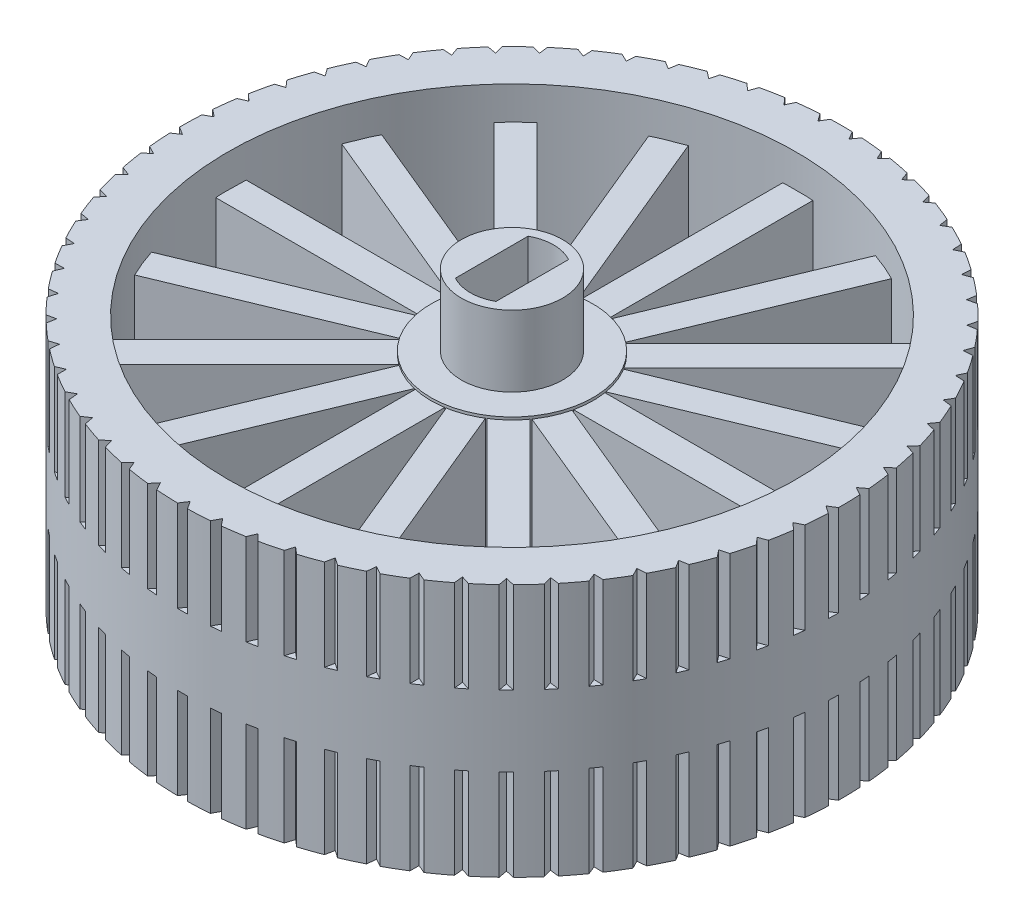
from build123d import *

# Parameters (mm, degrees)
SKETCH1_R               = 32.5
BOSS_EXTRUDE1_DEPTH     = 2
SKETCH2_R               = 4
BOSS_EXTRUDE2_DEPTH     = 2
CUT_EXTRUDE1_DEPTH      = 28
SKETCH5_R               = 8
BOSS_EXTRUDE3_DEPTH     = 2
CUT_EXTRUDE2_DEPTH      = 18
CUT_EXTRUDE2_DEPTH_BACK = 37.005434462
CUT_EXTRUDE2_START      = -10
SKETCH7_R               = 32.5
SKETCH7_R_2             = 28
BOSS_EXTRUDE4_DEPTH     = 23
BOSS_EXTRUDE5_START     = 25
SKETCH9_R               = 8
BOSS_EXTRUDE5_DEPTH     = 25
SKETCH12_W              = 3
SKETCH12_H              = 19.736770602
BOSS_EXTRUDE6_DEPTH     = 22
CIRPATTERN2_COUNT       = 16
CUT_EXTRUDE3_START      = -22
SKETCH13_R              = 28
CUT_EXTRUDE3_DEPTH      = 22
CUT_EXTRUDE6_DEPTH      = 9
SKETCH16_R              = 8
SKETCH16_R_2            = 5
CUT_EXTRUDE7_DEPTH      = 7


with BuildPart() as part:
    # Sketch1 → Boss-Extrude1 (new body)
    with BuildSketch(Plane(origin=(0, 0, 0), x_dir=(1, 0, 0), z_dir=(0, 1, 0))):
        with Locations(Location((0, 0, 0), (0, 0, 270))):
            Circle(SKETCH1_R)
    extrude(amount=BOSS_EXTRUDE1_DEPTH)

    # Sketch2 → Boss-Extrude2 (add)
    with BuildSketch(Plane(origin=(0, 2, 0), x_dir=(1, 0, 0), z_dir=(0, 1, 0))):
        with Locations(Location((0, 0, 0), (0, 0, 270))):
            Circle(SKETCH2_R)
    extrude(amount=BOSS_EXTRUDE2_DEPTH)

    # Sketch4 → Cut-Extrude1 (cut)
    with BuildSketch(Plane(origin=(0, 4, 0), x_dir=(1, 0, 0), z_dir=(0, 1, 0))):
        with BuildLine():
            Line((1.995, -3.581895448), (1.995, 3.581895448))
            ThreePointArc((1.995, 3.581895448), (0, 4.1), (-1.995, 3.581895448))
            Line((-1.995, 3.581895448), (-1.995, -3.581895448))
            ThreePointArc((-1.995, -3.581895448), (0, -4.1), (1.995, -3.581895448))
        make_face()
    extrude(amount=-CUT_EXTRUDE1_DEPTH, mode=Mode.SUBTRACT)

    # Sketch5 → Boss-Extrude3 (add)
    with BuildSketch(Plane(origin=(0, 2, 0), x_dir=(1, 0, 0), z_dir=(0, 1, 0))):
        with Locations(Location((0, 0, 0), (0, 0, 270))):
            Circle(SKETCH5_R)
    extrude(amount=BOSS_EXTRUDE3_DEPTH)

    # Sketch6 → Cut-Extrude2 (cut, two sides: drawn at the far end of the back side and taken through both)
    with BuildSketch(Plane.XZ.offset(-2).offset(CUT_EXTRUDE2_START - CUT_EXTRUDE2_DEPTH_BACK)):
        with BuildLine():
            Line((-1.995, 3.581895448), (-1.995, -3.581895448))
            ThreePointArc((-1.995, -3.581895448), (0, -4.1), (1.995, -3.581895448))
            Line((1.995, -3.581895448), (1.995, 3.581895448))
            ThreePointArc((1.995, 3.581895448), (0, 4.1), (-1.995, 3.581895448))
        make_face()
    extrude(amount=CUT_EXTRUDE2_DEPTH + CUT_EXTRUDE2_DEPTH_BACK, mode=Mode.SUBTRACT)

    # Sketch7 → Boss-Extrude4 (add)
    with BuildSketch(Plane(origin=(0, 2, 0), x_dir=(1, 0, 0), z_dir=(0, 1, 0))):
        with Locations(Location((0, 0, 0), (0, 0, 270))):
            Circle(SKETCH7_R)
        with Locations(Location((0, 0, 0), (0, 0, 270))):
            Circle(SKETCH7_R_2, mode=Mode.SUBTRACT)
    extrude(amount=BOSS_EXTRUDE4_DEPTH)

    # Sketch9 → Boss-Extrude5 (add)
    with BuildSketch(Plane(origin=(0, 4, 0), x_dir=(1, 0, 0), z_dir=(0, 1, 0)).offset(BOSS_EXTRUDE5_START)):
        with Locations(Location((0, 0, 0), (0, 0, 270))):
            Circle(SKETCH9_R)
        with BuildLine():
            Line((-1.995, -3.581895448), (-1.995, 3.581895448))
            ThreePointArc((-1.995, 3.581895448), (0, 4.1), (1.995, 3.581895448))
            Line((1.995, 3.581895448), (1.995, -3.581895448))
            ThreePointArc((1.995, -3.581895448), (0, -4.1), (-1.995, -3.581895448))
        make_face(mode=Mode.SUBTRACT)
    extrude(amount=-BOSS_EXTRUDE5_DEPTH)

    # Sketch13 → Cut-Extrude3 (cut)
    with BuildSketch(Plane(origin=(0, 2, 0), x_dir=(1, 0, 0), z_dir=(0, 1, 0)).offset(CUT_EXTRUDE3_START)):
        with Locations(Location((0, 0, 0), (0, 0, 270))):
            Circle(SKETCH13_R)
    extrude(amount=CUT_EXTRUDE3_DEPTH, mode=Mode.SUBTRACT)


with BuildPart() as body_2:
    # Sketch12 → Boss-Extrude6 (new body)
    with BuildSketch(Plane(origin=(-6.995, 0, 0), x_dir=(0, 0, -1), z_dir=(1, 0, 0))):
        with Locations((0.23460174, 11.868385301)):
            Rectangle(SKETCH12_W, SKETCH12_H)
    extrude(amount=-BOSS_EXTRUDE6_DEPTH)


with BuildPart() as cirpattern2_1:
    # CirPattern2: pattern copy
    add(body_2.part.rotate(Axis((0, 0, 0), (0, 1, 0)), 1 * 360 / CIRPATTERN2_COUNT))


with BuildPart() as cirpattern2_2:
    # CirPattern2: pattern copy
    add(body_2.part.rotate(Axis((0, 0, 0), (0, 1, 0)), 2 * 360 / CIRPATTERN2_COUNT))


with BuildPart() as cirpattern2_3:
    # CirPattern2: pattern copy
    add(body_2.part.rotate(Axis((0, 0, 0), (0, 1, 0)), 3 * 360 / CIRPATTERN2_COUNT))


with BuildPart() as cirpattern2_4:
    # CirPattern2: pattern copy
    add(body_2.part.rotate(Axis((0, 0, 0), (0, 1, 0)), 4 * 360 / CIRPATTERN2_COUNT))


with BuildPart() as cirpattern2_5:
    # CirPattern2: pattern copy
    add(body_2.part.rotate(Axis((0, 0, 0), (0, 1, 0)), 5 * 360 / CIRPATTERN2_COUNT))


with BuildPart() as cirpattern2_6:
    # CirPattern2: pattern copy
    add(body_2.part.rotate(Axis((0, 0, 0), (0, 1, 0)), 6 * 360 / CIRPATTERN2_COUNT))


with BuildPart() as cirpattern2_7:
    # CirPattern2: pattern copy
    add(body_2.part.rotate(Axis((0, 0, 0), (0, 1, 0)), 7 * 360 / CIRPATTERN2_COUNT))


with BuildPart() as cirpattern2_8:
    # CirPattern2: pattern copy
    add(body_2.part.rotate(Axis((0, 0, 0), (0, 1, 0)), 8 * 360 / CIRPATTERN2_COUNT))


with BuildPart() as cirpattern2_9:
    # CirPattern2: pattern copy
    add(body_2.part.rotate(Axis((0, 0, 0), (0, 1, 0)), 9 * 360 / CIRPATTERN2_COUNT))


with BuildPart() as cirpattern2_10:
    # CirPattern2: pattern copy
    add(body_2.part.rotate(Axis((0, 0, 0), (0, 1, 0)), 10 * 360 / CIRPATTERN2_COUNT))


with BuildPart() as cirpattern2_11:
    # CirPattern2: pattern copy
    add(body_2.part.rotate(Axis((0, 0, 0), (0, 1, 0)), 11 * 360 / CIRPATTERN2_COUNT))


with BuildPart() as cirpattern2_12:
    # CirPattern2: pattern copy
    add(body_2.part.rotate(Axis((0, 0, 0), (0, 1, 0)), 12 * 360 / CIRPATTERN2_COUNT))


with BuildPart() as cirpattern2_13:
    # CirPattern2: pattern copy
    add(body_2.part.rotate(Axis((0, 0, 0), (0, 1, 0)), 13 * 360 / CIRPATTERN2_COUNT))


with BuildPart() as cirpattern2_14:
    # CirPattern2: pattern copy
    add(body_2.part.rotate(Axis((0, 0, 0), (0, 1, 0)), 14 * 360 / CIRPATTERN2_COUNT))


with BuildPart() as cirpattern2_15:
    # CirPattern2: pattern copy
    add(body_2.part.rotate(Axis((0, 0, 0), (0, 1, 0)), 15 * 360 / CIRPATTERN2_COUNT))


with BuildPart() as cut_extrude3_piece_1:
    # of the separate pieces the step leaves, piece 1, a body of its own (cut_extrude3_pieces)
    add(part.part.solids().sort_by_distance((0, 0, 32.5))[0])

    # Sketch14 → Cut-Extrude6 (cut)
    with BuildSketch(Plane.XZ):
        Polygon((0, 31.75), (-0.527732221, 32.541598332), (0.518724425, 32.537676028), align=None)
        Polygon((3.656641521, 32.335714142), (2.615448673, 32.44061577), (3.064316989, 31.601779402), align=None)
        Polygon((6.76041754, 31.831842406), (5.734209828, 32.036743919), (6.100023276, 31.158501505), align=None)
        Polygon((9.801073362, 31.030765335), (8.799432211, 31.333753622), (9.078775289, 30.424305074), align=None)
        Polygon((12.750219203, 29.939962368), (11.782496667, 30.33820851), (11.972761224, 29.406045104), align=None)
        Polygon((15.580319683, 28.569618039), (14.655551125, 29.059403719), (14.754960712, 28.113228814), align=None)
        Polygon((18.264950915, 26.932526884), (17.391770651, 27.509279105), (17.399397109, 26.557926882), align=None)
        Polygon((20.779047222, 25.043973983), (19.965607901, 25.702307765), (19.881380022, 24.754660742), align=None)
        Polygon((23.099135164, 22.921592244), (22.353031649, 23.655360901), (22.177735847, 22.720267004), align=None)
        Polygon((25.203552704, 20.585197774), (24.531751163, 21.387550307), (24.267024127, 20.473740254), align=None)
        Polygon((27.072651464, 18.056604859), (26.481424327, 18.920049918), (26.129737742, 18.036055709), align=None)
        Polygon((28.688980171, 15.359422289), (28.183847566, 16.275898121), (27.748485036, 15.42997337), align=None)
        Polygon((30.0374476, 12.518832932), (29.623125815, 13.479782648), (29.108152201, 12.679825528), align=None)
        Polygon((31.105463474, 9.561358605), (30.785820919, 10.557810076), (30.196044392, 9.811289571), align=None)
        Polygon((31.883056017, 6.514612449), (31.661077108, 7.537262077), (31.002004253, 6.851148247), align=None)
        Polygon((32.362965055, 3.407041111), (32.240722351, 4.446340692), (31.518506753, 3.827039598), align=None)
        Polygon((32.540709809, 0.267659149), (32.519344656, 1.313905022), (31.740729447, 0.767198911), align=None)
        Polygon((32.414630723, -2.874221875), (32.494342602, -1.830798224), (31.666597503, -2.299804905), align=None)
        Polygon((31.985904964, -5.989267063), (32.165949626, -4.958407802), (31.29680307, -5.345336063), align=None)
        Polygon((31.258535428, -9.048392079), (31.537231845, -8.039722061), (30.634798819, -8.340959258), align=None)
        Polygon((30.239313369, -12.023034696), (30.614059428, -11.045971602), (29.686765705, -11.258705164), align=None)
        Polygon((28.937754988, -14.885421477), (29.405051786, -13.949087882), (28.461555259, -14.071331573), align=None)
        Polygon((27.366012586, -17.608827088), (27.921497098, -16.721965287), (26.97060694, -16.75257775), align=None)
        Polygon((25.538761098, -20.167823826), (26.177246915, -19.338714208), (25.227841331, -19.277409623), align=None)
        Polygon((23.473061079, -22.538519026), (24.188586831, -21.774902764), (23.249530164, -21.622253516), align=None)
        Polygon((21.188199413, -24.698778147), (21.974084429, -24.007784921), (21.054144399, -23.765216254), align=None)
        Polygon((18.705509237, -26.628431431), (19.554415921, -26.016512858), (18.66218176, -25.686289571), align=None)
        Polygon((16.048170762, -28.309462225), (16.9521731, -27.782331624), (16.095975359, -27.367536923), align=None)
        Polygon((13.240994841, -29.726175199), (14.191652406, -29.288754246), (13.379485172, -28.793260957), align=None)
        Polygon((10.310191318, -30.865342883), (11.298628078, -30.52171566), (10.538074337, -29.950150071), align=None)
        Polygon((7.283124317, -31.716329178), (8.300111504, -31.469704039), (7.598272341, -30.827402703), align=None)
        Polygon((4.188056746, -32.271188652), (5.224099024, -32.123868271), (4.587527324, -31.416828183), align=None)
        Polygon((1.053886418, -32.524740733), (2.09931054, -32.478100599), (1.5339498, -31.712923202), align=None)
        Polygon((-2.090123764, -32.474618073), (-1.045078641, -32.529093653), (-1.5339498, -31.712923202), align=None)
        Polygon((-5.214619023, -32.121288653), (-4.179710204, -32.276371325), (-4.587527324, -31.416828183), align=None)
        Polygon((-8.290426789, -31.468051417), (-7.27531694, -31.722293213), (-7.598272341, -30.827402703), align=None)
        Polygon((-11.288829075, -30.521005462), (-10.302996001, -30.872032597), (-10.538074337, -29.950150071), align=None)
        Polygon((-14.181830604, -29.288993104), (-13.234478765, -29.733528131), (-13.379485172, -28.793260957), align=None)
        Polygon((-16.942420203, -27.783517308), (-16.042394766, -28.317409723), (-16.095975359, -27.367536923), align=None)
        Polygon((-19.544822989, -26.018634297), (-18.70052725, -26.636899291), (-18.66218176, -25.686289571), align=None)
        Polygon((-21.964741028, -24.010822307), (-21.184057949, -24.707687307), (-21.054144399, -23.765216254), align=None)
        Polygon((-24.179580199, -21.77882774), (-23.469798808, -22.547786304), (-23.249530164, -21.622253516), align=None)
        Polygon((-26.168661144, -19.343490125), (-25.536408478, -20.177362695), (-25.227841331, -19.277409623), align=None)
        Polygon((-27.913412351, -16.727547555), (-27.364591582, -17.618548488), (-26.97060694, -16.75257775), align=None)
        Polygon((-29.397543548, -13.955424381), (-28.937278868, -14.89523464), (-28.461555259, -14.071331573), align=None)
        Polygon((-30.607197801, -11.053003169), (-30.239786578, -12.032847999), (-29.686765705, -11.258705164), align=None)
        Polygon((-31.531080896, -8.047383045), (-31.259953549, -9.058113899), (-30.634798819, -8.340959258), align=None)
        Polygon((-32.160566783, -4.966626673), (-31.988254755, -5.99880663), (-31.29680307, -5.345336063), align=None)
        Polygon((-32.489778123, -1.839498247), (-32.417890246, -2.88349012), (-31.666597503, -2.299804905), align=None)
        Polygon((-32.51564116, 1.304805079), (-32.54484863, 0.258748761), (-31.740729447, 0.767198911), align=None)
        Polygon((-32.237914415, 4.436925792), (-32.367944531, 3.398571774), (-31.518506753, 3.827039598), align=None)
        Polygon((-31.65919095, 7.527620124), (-31.888829655, 6.506663238), (-31.002004253, 6.851148247), align=None)
        Polygon((-30.784874148, 10.548031095), (-31.111977369, 9.554003741), (-30.196044392, 9.811289571), align=None)
        Polygon((-29.623127272, 13.469957942), (-30.044640932, 12.512141085), (-29.108152201, 12.679825528), align=None)
        Polygon((-28.184797237, 16.266119421), (-28.696785779, 15.353455939), (-27.748485036, 15.42997337), align=None)
        Polygon((-26.483313345, 18.910408525), (-27.080996468, 18.051419711), (-26.129737742, 18.036055709), align=None)
        Polygon((-24.534561892, 21.37813624), (-25.21235919, 20.580842241), (-24.267024127, 20.473740254), align=None)
        Polygon((-22.356737844, 23.646262057), (-23.108320907, 22.918106993), (-22.177735847, 22.720267004), align=None)
        Polygon((-19.970174959, 25.693609096), (-20.788526458, 25.041391554), (-19.881380022, 24.754660742), align=None)
        Polygon((-17.397155932, 27.50106183), (-18.274635139, 26.93087139), (-17.399397109, 26.557926882), align=None)
        Polygon((-14.661704346, 29.05174456), (-15.590118475, 28.568904935), (-14.754960712, 28.113228814), align=None)
        Polygon((-11.789360378, 30.331178978), (-12.760041076, 29.940198313), (-11.972761224, 29.406045104), align=None)
        Polygon((-8.806942328, 31.32741935), (-9.810826611, 31.031948126), (-9.078775289, 30.424305074), align=None)
        Polygon((-5.742296231, 32.031164049), (-6.770011101, 31.833961), (-6.100023276, 31.158501505), align=None)
        Polygon((-2.62403586, 32.435842399), (-3.665985822, 32.338748758), (-3.064316989, 31.601779402), align=None)
    cut_extrude6 = extrude(amount=-CUT_EXTRUDE6_DEPTH, mode=Mode.SUBTRACT)

    # Mirror1: Cut-Extrude6 across plane
    add(cut_extrude6.mirror(Plane.ZX.offset(12.5)), mode=Mode.SUBTRACT)


with BuildPart() as cut_extrude3_piece_2:
    # of the separate pieces the step leaves, piece 2, a body of its own (cut_extrude3_pieces)
    add(part.part.solids().sort_by_distance((1.995, 2, 3.581895448))[0])

    # Sketch16 → Cut-Extrude7 (cut)
    with BuildSketch(Plane(origin=(0, 29, 0), x_dir=(1, 0, 0), z_dir=(0, 1, 0))):
        with Locations(Location((0, 0, 0), (0, 0, 270))):
            Circle(SKETCH16_R)
        with Locations(Location((0, 0, 0), (0, 0, 270))):
            Circle(SKETCH16_R_2, mode=Mode.SUBTRACT)
    extrude(amount=-CUT_EXTRUDE7_DEPTH, mode=Mode.SUBTRACT)


solid = Compound([body_2.part, cirpattern2_1.part, cirpattern2_2.part, cirpattern2_3.part, cirpattern2_4.part, cirpattern2_5.part, cirpattern2_6.part, cirpattern2_7.part, cirpattern2_8.part, cirpattern2_9.part, cirpattern2_10.part, cirpattern2_11.part, cirpattern2_12.part, cirpattern2_13.part, cirpattern2_14.part, cirpattern2_15.part, cut_extrude3_piece_1.part, cut_extrude3_piece_2.part])
